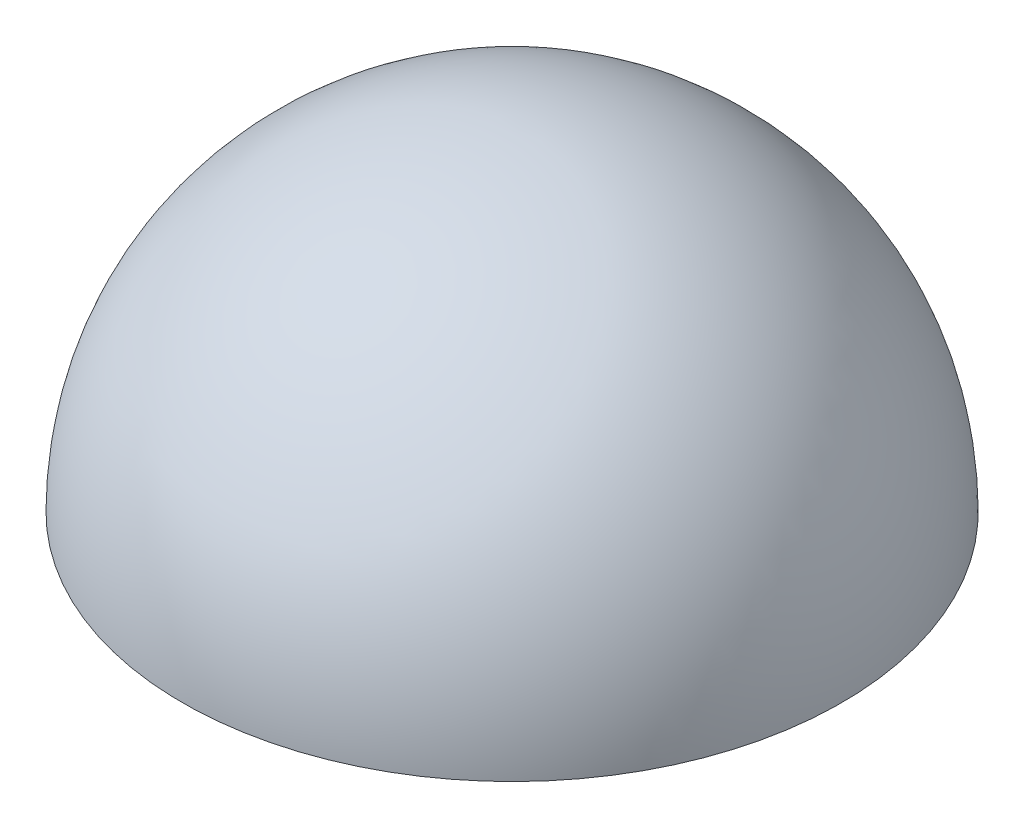
from build123d import *

# Parameters (mm, degrees)
REVOLVE1_ANGLE     = 180
SKETCH2_R          = 4
CUT_EXTRUDE1_DEPTH = 5


with BuildPart() as part:
    # Sketch1 → Revolve1 (revolve)
    with BuildSketch(Plane(origin=(0, 0, 0), x_dir=(1, 0, 0), z_dir=(0, 1, 0))):
        with BuildLine():
            Line((-10, 0), (10, 0))
            ThreePointArc((10, 0), (0, 10), (-10, 0))
        make_face()
    revolve(axis=Axis((-10, 0, 0), (1, 0, 0)), revolution_arc=REVOLVE1_ANGLE)

    # Sketch2 → Cut-Extrude1 (cut)
    with BuildSketch(Plane.XZ):
        with Locations(Location((0, 0, 0), (0, 0, 270))):
            Circle(SKETCH2_R)
    extrude(amount=-CUT_EXTRUDE1_DEPTH, mode=Mode.SUBTRACT)


solid = part.part
